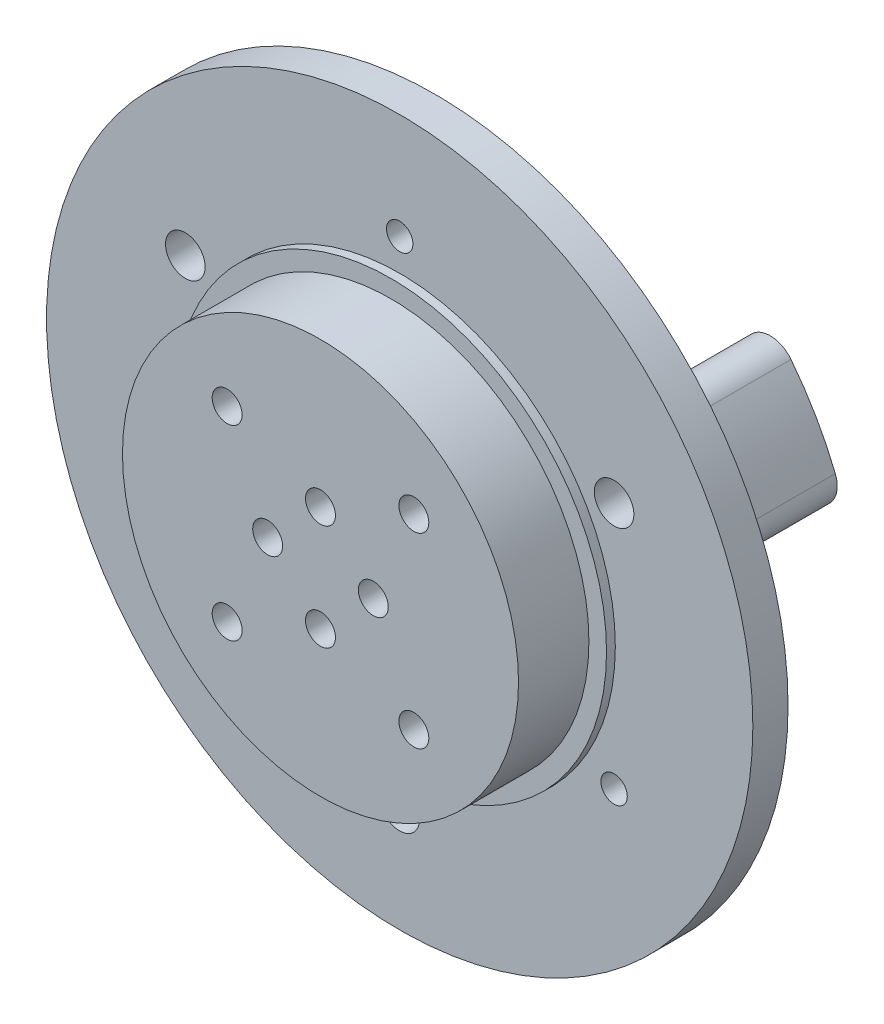
from build123d import *
from build123d.topology import SkipClean

# Parameters (mm, degrees)
SKETCH1_R                = 40.125
SKETCH1_R_2              = 6
BOSS_EXTRUDE1_DEPTH      = 4
SKETCH1_3_R              = 6
BOSS_EXTRUDE2_DEPTH      = 4.8
SKETCH2_R                = 7
SKETCH2_R_2              = 6
BOSS_EXTRUDE3_DEPTH      = 1
SKETCH3_R                = 22.5
BOSS_EXTRUDE4_DEPTH      = 9
SKETCH3_3_R              = 24.5
SKETCH3_3_R_2            = 22.5
BOSS_EXTRUDE5_DEPTH      = 1
CUT_EXTRUDE1_REACH       = 61.472
SKETCH4_R                = 1.7
SKETCH5_R                = 1.5
CUT_EXTRUDE2_DEPTH       = 60.471600365
SKETCH7_R                = 2.25
CUT_EXTRUDE4_DEPTH       = 5
CIRPATTERN2_COUNT        = 4
SKETCH8_R                = 1.5
BOSS_EXTRUDE6_DEPTH      = 12
FILLET1_R                = 3
SKETCH8_2_R              = 1.5
CUT_EXTRUDE5_DEPTH       = 59.215386712
CIRPATTERN3_COUNT        = 3
FILLET1_OF_CIRPATTERN3_R = 3
SKETCH6_R                = 2.25
CUT_EXTRUDE3_DEPTH       = 5
CIRPATTERN1_COUNT        = 6
SKETCH6_2_R              = 2.25
SKETCH6_2_R_2            = 1.5
BOSS_EXTRUDE7_DEPTH      = 5


with BuildPart() as part:
    # Sketch1 → Boss-Extrude1 (new body)
    # profile 1 of 4: a face of its own
    with BuildSketch(Plane.XY):
        Circle(SKETCH1_R)
        with Locations((0, 28.125)):
            Circle(SKETCH1_R_2, mode=Mode.SUBTRACT)
        with Locations((24.356964481, -14.0625)):
            Circle(SKETCH1_R_2, mode=Mode.SUBTRACT)
        with Locations((-24.356964481, -14.0625)):
            Circle(SKETCH1_R_2, mode=Mode.SUBTRACT)
    # profile 2 of 4: a face of its own
    with BuildSketch(Plane.XY):
        with Locations((0, 28.125)):
            Circle(SKETCH1_R_2)
    # profile 3 of 4: a face of its own
    with BuildSketch(Plane.XY):
        with Locations((-24.356964481, -14.0625)):
            Circle(SKETCH1_R_2)
    # profile 4 of 4: a face of its own
    with BuildSketch(Plane.XY):
        with Locations((24.356964481, -14.0625)):
            Circle(SKETCH1_R_2)
    extrude(amount=BOSS_EXTRUDE1_DEPTH)

    # Sketch1<3> → Boss-Extrude2 (add)
    with BuildSketch(Plane.XY):
        with Locations((0, 28.125)):
            Circle(SKETCH1_3_R)
        with Locations((24.356964481, -14.0625)):
            Circle(SKETCH1_3_R)
        with Locations((-24.356964481, -14.0625)):
            Circle(SKETCH1_3_R)
    extrude(amount=-BOSS_EXTRUDE2_DEPTH)

    # Sketch2 → Boss-Extrude3 (add)
    # profile 1 of 3: a face of its own
    with BuildSketch(Plane(origin=(0, 0, 0), x_dir=(-1, 0, 0), z_dir=(0, 0, -1))):
        with Locations(Location((0, 28.125, 0), (0, 0, 180))):
            Circle(SKETCH2_R)
        with Locations(Location((0, 28.125, 0), (0, 0, 180))):
            Circle(SKETCH2_R_2, mode=Mode.SUBTRACT)
    # profile 2 of 3: a face of its own
    with BuildSketch(Plane(origin=(0, 0, 0), x_dir=(-1, 0, 0), z_dir=(0, 0, -1))):
        with Locations(Location((-24.356964481, -14.0625, 0), (0, 0, 180))):
            Circle(SKETCH2_R)
        with Locations(Location((-24.356964481, -14.0625, 0), (0, 0, 180))):
            Circle(SKETCH2_R_2, mode=Mode.SUBTRACT)
    # profile 3 of 3: a face of its own
    with BuildSketch(Plane(origin=(0, 0, 0), x_dir=(-1, 0, 0), z_dir=(0, 0, -1))):
        with Locations(Location((24.356964481, -14.0625, 0), (0, 0, 180))):
            Circle(SKETCH2_R)
        with Locations(Location((24.356964481, -14.0625, 0), (0, 0, 180))):
            Circle(SKETCH2_R_2, mode=Mode.SUBTRACT)
    extrude(amount=BOSS_EXTRUDE3_DEPTH)

    # Sketch3 → Boss-Extrude4 (add)
    with BuildSketch(Plane.XY.offset(4)):
        Circle(SKETCH3_R)
    extrude(amount=BOSS_EXTRUDE4_DEPTH)

    # Sketch3<3> → Boss-Extrude5 (add)
    with BuildSketch(Plane.XY.offset(4)):
        Circle(SKETCH3_3_R)
        Circle(SKETCH3_3_R_2, mode=Mode.SUBTRACT)
    extrude(amount=BOSS_EXTRUDE5_DEPTH)

    # Sketch4 → Cut-Extrude1 (cut, up to next)
    with BuildSketch(Plane.XY.offset(13), mode=Mode.PRIVATE) as cut_extrude1_sk1:
        with Locations((0, 6)):
            Circle(SKETCH4_R)
    cut_extrude1_tool1 = extrude(cut_extrude1_sk1.sketch, amount=-CUT_EXTRUDE1_REACH, mode=Mode.PRIVATE) & part.part
    # Sketch4 → Cut-Extrude1 (cut, up to next)
    with BuildSketch(Plane.XY.offset(13), mode=Mode.PRIVATE) as cut_extrude1_sk2:
        with Locations((6, 0)):
            Circle(SKETCH4_R)
    cut_extrude1_tool2 = extrude(cut_extrude1_sk2.sketch, amount=-CUT_EXTRUDE1_REACH, mode=Mode.PRIVATE) & part.part
    # Sketch4 → Cut-Extrude1 (cut, up to next)
    with BuildSketch(Plane.XY.offset(13), mode=Mode.PRIVATE) as cut_extrude1_sk3:
        with Locations((0, -6)):
            Circle(SKETCH4_R)
    cut_extrude1_tool3 = extrude(cut_extrude1_sk3.sketch, amount=-CUT_EXTRUDE1_REACH, mode=Mode.PRIVATE) & part.part
    # Sketch4 → Cut-Extrude1 (cut, up to next)
    with BuildSketch(Plane.XY.offset(13), mode=Mode.PRIVATE) as cut_extrude1_sk4:
        with Locations((-6, 0)):
            Circle(SKETCH4_R)
    cut_extrude1_tool4 = extrude(cut_extrude1_sk4.sketch, amount=-CUT_EXTRUDE1_REACH, mode=Mode.PRIVATE) & part.part
    # Sketch4 → Cut-Extrude1 (cut, up to next)
    with BuildSketch(Plane.XY.offset(13), mode=Mode.PRIVATE) as cut_extrude1_sk5:
        with Locations((-10.606601718, 10.606601718)):
            Circle(SKETCH4_R)
    cut_extrude1_tool5 = extrude(cut_extrude1_sk5.sketch, amount=-CUT_EXTRUDE1_REACH, mode=Mode.PRIVATE) & part.part
    # Sketch4 → Cut-Extrude1 (cut, up to next)
    with BuildSketch(Plane.XY.offset(13), mode=Mode.PRIVATE) as cut_extrude1_sk6:
        with Locations((10.606601718, 10.606601718)):
            Circle(SKETCH4_R)
    cut_extrude1_tool6 = extrude(cut_extrude1_sk6.sketch, amount=-CUT_EXTRUDE1_REACH, mode=Mode.PRIVATE) & part.part
    # Sketch4 → Cut-Extrude1 (cut, up to next)
    with BuildSketch(Plane.XY.offset(13), mode=Mode.PRIVATE) as cut_extrude1_sk7:
        with Locations((10.606601718, -10.606601718)):
            Circle(SKETCH4_R)
    cut_extrude1_tool7 = extrude(cut_extrude1_sk7.sketch, amount=-CUT_EXTRUDE1_REACH, mode=Mode.PRIVATE) & part.part
    # Sketch4 → Cut-Extrude1 (cut, up to next)
    with BuildSketch(Plane.XY.offset(13), mode=Mode.PRIVATE) as cut_extrude1_sk8:
        with Locations((-10.606601718, -10.606601718)):
            Circle(SKETCH4_R)
    cut_extrude1_tool8 = extrude(cut_extrude1_sk8.sketch, amount=-CUT_EXTRUDE1_REACH, mode=Mode.PRIVATE) & part.part
    add(cut_extrude1_tool1.solids().sort_by_distance((0, 6, 13))[0], mode=Mode.SUBTRACT)
    add(cut_extrude1_tool2.solids().sort_by_distance((6, 0, 13))[0], mode=Mode.SUBTRACT)
    add(cut_extrude1_tool3.solids().sort_by_distance((0, -6, 13))[0], mode=Mode.SUBTRACT)
    add(cut_extrude1_tool4.solids().sort_by_distance((-6, 0, 13))[0], mode=Mode.SUBTRACT)
    add(cut_extrude1_tool5.solids().sort_by_distance((-10.606602, 10.606602, 13))[0], mode=Mode.SUBTRACT)
    add(cut_extrude1_tool6.solids().sort_by_distance((10.606602, 10.606602, 13))[0], mode=Mode.SUBTRACT)
    add(cut_extrude1_tool7.solids().sort_by_distance((10.606602, -10.606602, 13))[0], mode=Mode.SUBTRACT)
    add(cut_extrude1_tool8.solids().sort_by_distance((-10.606602, -10.606602, 13))[0], mode=Mode.SUBTRACT)

    # Sketch5 → Cut-Extrude2 (cut, through all)
    with BuildSketch(Plane(origin=(0, 0, -4.8), x_dir=(-1, 0, 0), z_dir=(0, 0, -1))):
        with Locations((0, 28.125)):
            Circle(SKETCH5_R)
        with Locations((24.356964481, -14.0625)):
            Circle(SKETCH5_R)
        with Locations((-24.356964481, -14.0625)):
            Circle(SKETCH5_R)
    extrude(amount=-CUT_EXTRUDE2_DEPTH, mode=Mode.SUBTRACT)

    # Sketch7 → Cut-Extrude4 (cut)
    with BuildSketch(Plane(origin=(0, 0, 0), x_dir=(-1, 0, 0), z_dir=(0, 0, -1))):
        with Locations((0, 6)):
            Circle(SKETCH7_R)
    cut_extrude4 = extrude(amount=-CUT_EXTRUDE4_DEPTH, mode=Mode.SUBTRACT)

    # CirPattern2: Cut-Extrude4 ×4 about axis
    cirpattern2_axis = Axis((0, 0, 0), (0, 0, 1))
    for i in range(1, CIRPATTERN2_COUNT):
        add(cut_extrude4.rotate(cirpattern2_axis, i * 360 / CIRPATTERN2_COUNT), mode=Mode.SUBTRACT)

    # Sketch8 → Boss-Extrude6 (add)
    with BuildSketch(Plane(origin=(0, 0, 0), x_dir=(-1, 0, 0), z_dir=(0, 0, -1))):
        with BuildLine():
            Line((-34.699562443, 10.047685865), (-18.755875925, 7.296077254))
            ThreePointArc((-18.755875925, 7.296077254), (-17.428761251, 10.0625), (-15.696526212, 12.595026394))
            Line((-15.696526212, 12.595026394), (-26.05133243, 25.026859644))
            ThreePointArc((-26.05133243, 25.026859644), (-31.285167712, 18.0625), (-34.699562443, 10.047685865))
        make_face()
        with Locations((-24.356964481, 14.0625)):
            Circle(SKETCH8_R, mode=Mode.SUBTRACT)
    boss_extrude6 = extrude(amount=BOSS_EXTRUDE6_DEPTH)

    # Fillet1
    fillet1_edges = [part.edges().sort_by_distance(p)[0] for p in [
        (26.05133243, 25.026859644, -6),
        (34.699562443, 10.047685865, -6),
        (18.755875925, 7.296077254, -6),
        (15.696526212, 12.595026394, -6),
    ]]
    fillet(fillet1_edges, radius=FILLET1_R)

    # Sketch8<2> → Cut-Extrude5 (cut, through all)
    with SkipClean():  # the faces are left unmerged after this step: merging them gives an invalid solid
        with BuildSketch(Plane(origin=(0, 0, 0), x_dir=(-1, 0, 0), z_dir=(0, 0, -1))):
            with Locations(Location((-24.356964481, 14.0625, 0), (0, 0, 180))):
                Circle(SKETCH8_2_R)
        cut_extrude5 = extrude(amount=-CUT_EXTRUDE5_DEPTH, mode=Mode.SUBTRACT)

    # CirPattern3: Boss-Extrude6, Cut-Extrude5 ×3 about axis
    cirpattern3_axis = Axis((0, 0, 0), (0, 0, 1))
    add([boss_extrude6.rotate(cirpattern3_axis, i * 360 / CIRPATTERN3_COUNT) for i in range(1, CIRPATTERN3_COUNT)])
    add([cut_extrude5.rotate(cirpattern3_axis, i * 360 / CIRPATTERN3_COUNT) for i in range(1, CIRPATTERN3_COUNT)], mode=Mode.SUBTRACT)

    # Fillet1 of CirPattern3
    fillet1_of_cirpattern3_edges = [part.edges().sort_by_distance(p)[0] for p in [
        (-34.699562443, 10.047685865, -6),
        (-26.05133243, 25.026859644, -6),
        (-15.696526212, 12.595026394, -6),
        (-18.755875925, 7.296077254, -6),
        (8.648230013, -35.074545509, -6),
        (-8.648230013, -35.074545509, -6),
        (-3.059349712, -19.891103648, -6),
        (3.059349712, -19.891103648, -6),
    ]]
    fillet(fillet1_of_cirpattern3_edges, radius=FILLET1_OF_CIRPATTERN3_R)

    # Sketch6 → Cut-Extrude3 (cut)
    with BuildSketch(Plane.XY.offset(4)):
        with Locations((0, 28.125)):
            Circle(SKETCH6_R)
    cut_extrude3 = extrude(amount=-CUT_EXTRUDE3_DEPTH, mode=Mode.SUBTRACT)

    # CirPattern1: Cut-Extrude3 ×6 about axis, 2 skipped
    cirpattern1_axis = Axis((0, 0, 0), (0, 0, 1))
    add([cut_extrude3.rotate(cirpattern1_axis, i * 360 / CIRPATTERN1_COUNT) for i in range(1, CIRPATTERN1_COUNT) if i not in (2, 4)], mode=Mode.SUBTRACT)

    # Sketch6<2> → Boss-Extrude7 (add)
    with BuildSketch(Plane.XY.offset(4)):
        with Locations((0, 28.125)):
            Circle(SKETCH6_2_R)
        with Locations(Location((0, 28.125, 0), (0, 0, 180))):
            Circle(SKETCH6_2_R_2, mode=Mode.SUBTRACT)
    extrude(amount=-BOSS_EXTRUDE7_DEPTH)


solid = part.part
